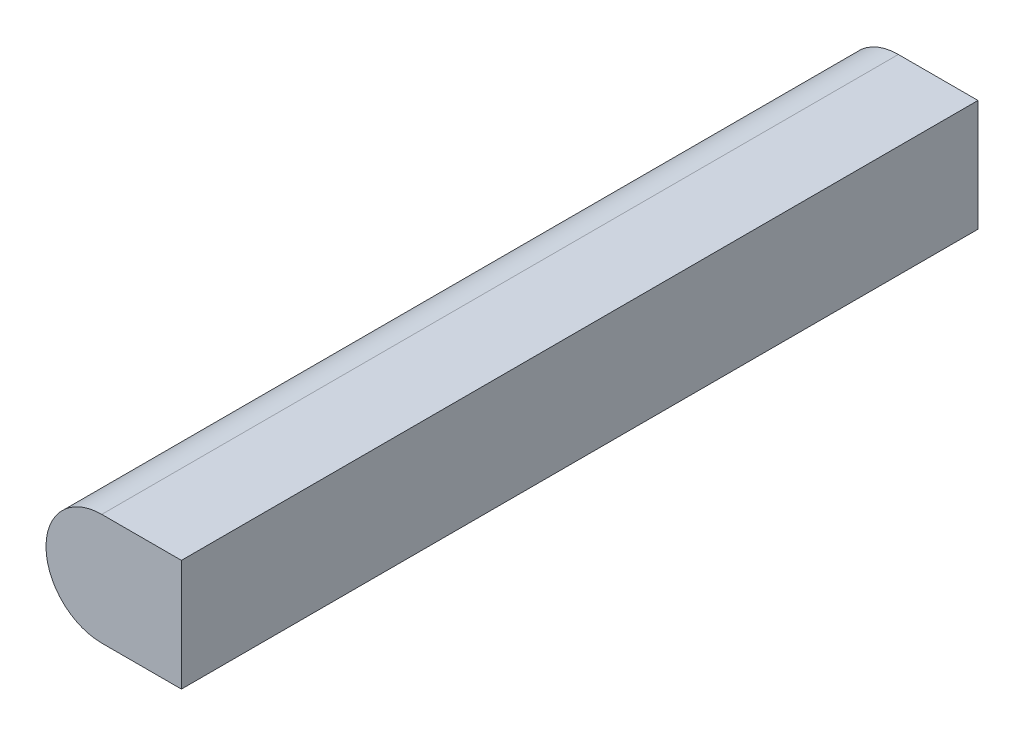
from build123d import *

# Parameters (mm, degrees)
SKETCH_1_W      = 14
SKETCH_1_H      = 10
EXTRUDE_2_DEPTH = 100
SKETCH_2_R      = 7
EXTRUDE_3_DEPTH = 100


with BuildPart() as part:
    # 草图1 → 凸台-拉伸2 (new body)
    with BuildSketch(Plane(origin=(0, 0, 0), x_dir=(0, -1, 0), z_dir=(0, 0, 1))):
        with Locations((7, 5)):
            Rectangle(SKETCH_1_W, SKETCH_1_H)
    extrude(amount=EXTRUDE_2_DEPTH)

    # 草图2 → 凸台-拉伸3 (add)
    with BuildSketch(Plane.XY.offset(100)):
        with Locations((0, -7)):
            Circle(SKETCH_2_R)
    extrude(amount=-EXTRUDE_3_DEPTH)


solid = part.part
